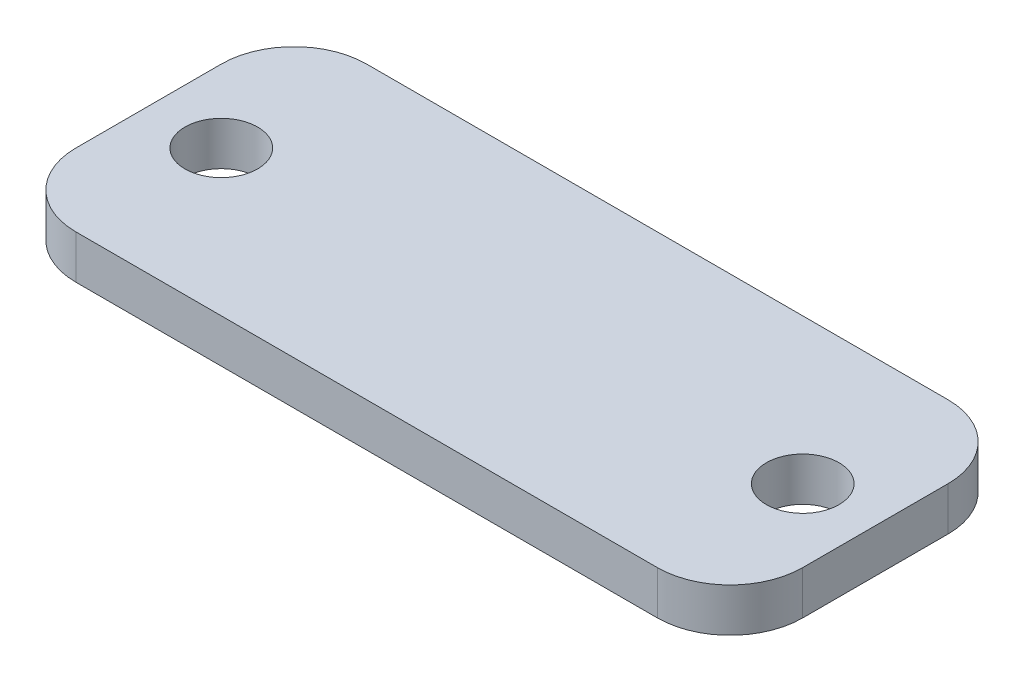
from build123d import *

# Parameters (mm, degrees)
SKETCH1_W           = 50
SKETCH1_H           = 20
SKETCH1_R           = 2.5
BOSS_EXTRUDE1_DEPTH = 3
FILLET1_R           = 5


with BuildPart() as part:
    # Sketch1 → Boss-Extrude1 (new body)
    with BuildSketch(Plane(origin=(0, 0, 0), x_dir=(1, 0, 0), z_dir=(0, 1, 0))):
        Rectangle(SKETCH1_W, SKETCH1_H)
        with Locations(Location((20, 0, 0), (0, 0, 270))):
            Circle(SKETCH1_R, mode=Mode.SUBTRACT)
        with Locations(Location((-20, 0, 0), (0, 0, 270))):
            Circle(SKETCH1_R, mode=Mode.SUBTRACT)
    extrude(amount=BOSS_EXTRUDE1_DEPTH)

    # Fillet1
    fillet1_edges = [part.edges().sort_by_distance(p)[0] for p in [
        (25, 1.5, 10),
        (-25, 1.5, 10),
        (-25, 1.5, -10),
        (25, 1.5, -10),
    ]]
    fillet(fillet1_edges, radius=FILLET1_R)


solid = part.part
